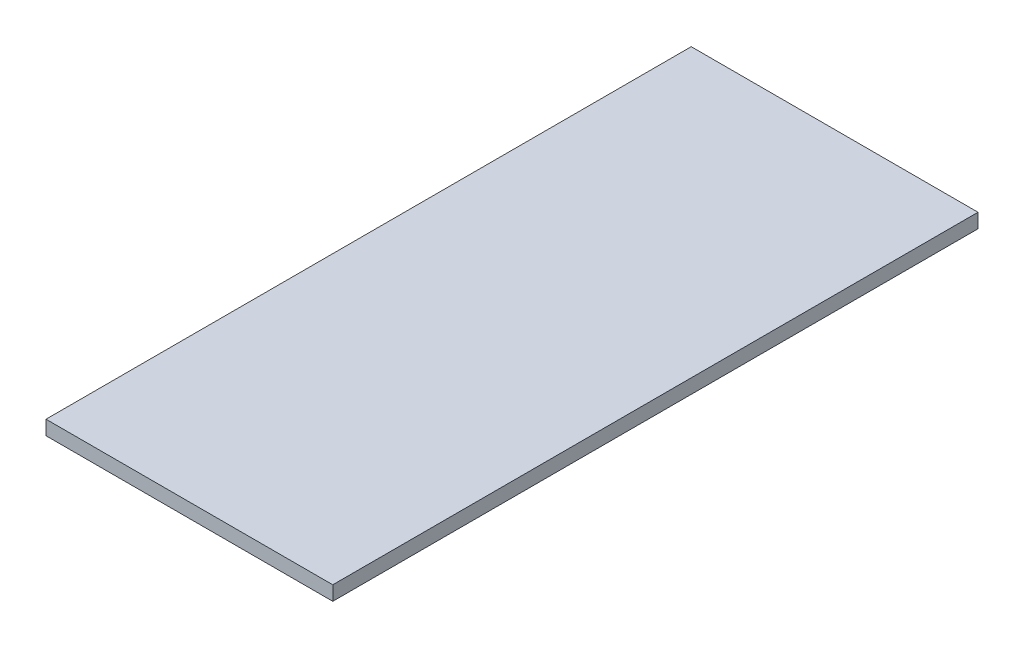
from build123d import *

# Parameters (mm, degrees)
SKETCH1_W           = 50.8
SKETCH1_H           = 114.3
BOSS_EXTRUDE1_DEPTH = 2.54


with BuildPart() as part:
    # Sketch1 → Boss-Extrude1 (new body)
    with BuildSketch(Plane(origin=(0, 0, 0), x_dir=(1, 0, 0), z_dir=(0, 1, 0))):
        with Locations((25.4, 57.15)):
            Rectangle(SKETCH1_W, SKETCH1_H)
    extrude(amount=BOSS_EXTRUDE1_DEPTH)


solid = part.part
